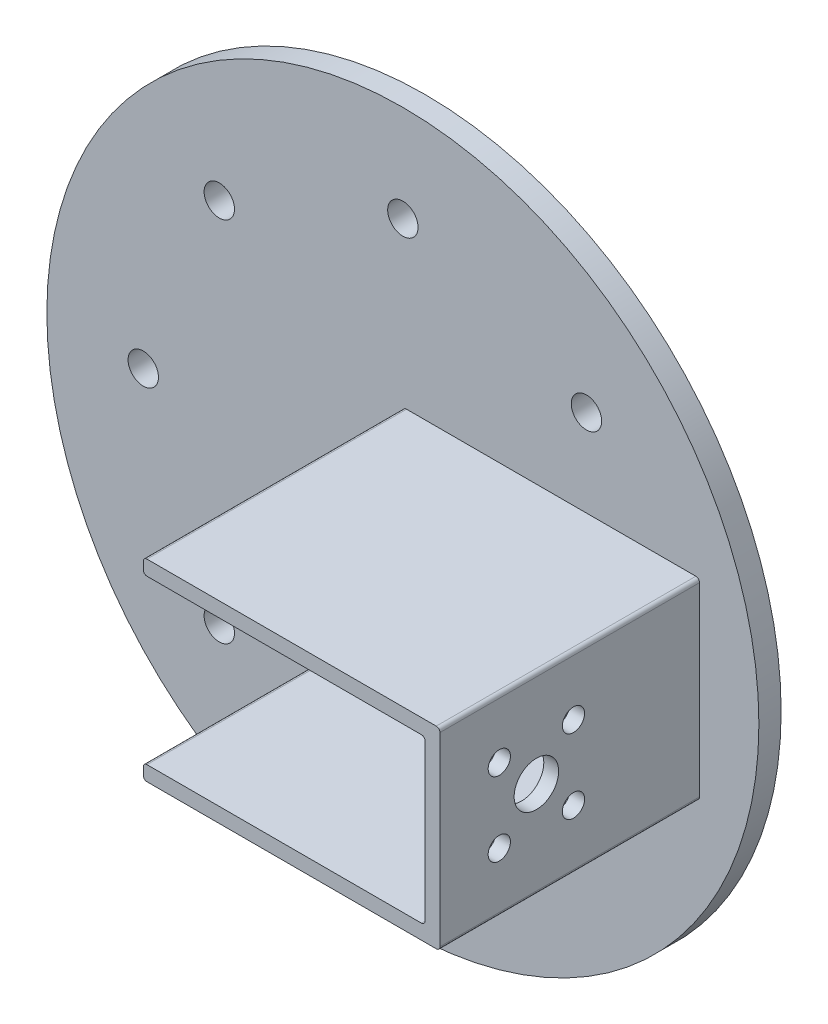
from build123d import *

# Parameters (mm, degrees)
SKETCH_3_R          = 48
EXTRUDE_2_DEPTH     = 3
SKETCH_4_R          = 3
CUT_EXTRUDE_1_DEPTH = 3
EXTRUDE_3_DEPTH     = 35
SKETCH_6_R          = 3
SKETCH_6_R_2        = 1.5
CUT_EXTRUDE_2_DEPTH = 35
SKETCH_7_R          = 1.55
CUT_EXTRUDE_5_DEPTH = 35
SKETCH_8_R          = 2.05
CUT_EXTRUDE_6_DEPTH = 10
SKETCH_9_R          = 1.55
CUT_EXTRUDE_7_DEPTH = 10


with BuildPart() as part:
    # 草图3 → 凸台-拉伸2 (new body)
    with BuildSketch(Plane.XY):
        Circle(SKETCH_3_R)
    extrude(amount=EXTRUDE_2_DEPTH)

    # 草图4 → 切除-拉伸1 (cut)
    with BuildSketch(Plane.XY.offset(3)):
        Circle(SKETCH_4_R)
    extrude(amount=-CUT_EXTRUDE_1_DEPTH, mode=Mode.SUBTRACT)

    # 草图5 → 凸台-拉伸3 (add)
    with BuildSketch(Plane.XY.offset(3)):
        with BuildLine():
            ThreePointArc((0, 12.5), (0.146446609, 12.853553391), (0.5, 13))
            Line((0.5, 13), (39.5, 13))
            ThreePointArc((39.5, 13), (39.853553391, 12.853553391), (40, 12.5))
            Line((40, 12.5), (40, -12.5))
            ThreePointArc((40, -12.5), (39.853553391, -12.853553391), (39.5, -13))
            Line((39.5, -13), (0.5, -13))
            ThreePointArc((0.5, -13), (0.146446609, -12.853553391), (0, -12.5))
            Line((0, -12.5), (0, -11.5))
            ThreePointArc((0, -11.5), (0.146446609, -11.146446609), (0.5, -11))
            Line((0.5, -11), (37.5, -11))
            ThreePointArc((37.5, -11), (37.853553391, -10.853553391), (38, -10.5))
            Line((38, -10.5), (38, 0))
            Line((38, 0), (38, 10.5))
            ThreePointArc((38, 10.5), (37.853553391, 10.853553391), (37.5, 11))
            Line((37.5, 11), (0.5, 11))
            ThreePointArc((0.5, 11), (0.146446609, 11.146446609), (0, 11.5))
            Line((0, 11.5), (0, 12.5))
        make_face()
    extrude(amount=EXTRUDE_3_DEPTH)

    # 草图6 → 切除-拉伸2 (cut)
    with BuildSketch(Plane(origin=(40, 0, 0), x_dir=(0, 0, -1), z_dir=(1, 0, 0))):
        with Locations((-25, 0)):
            Circle(SKETCH_6_R)
        with Locations((-20, -5)):
            Circle(SKETCH_6_R_2)
        with Locations((-20, 5)):
            Circle(SKETCH_6_R_2)
        with Locations((-30, -5)):
            Circle(SKETCH_6_R_2)
        with Locations((-30, 5)):
            Circle(SKETCH_6_R_2)
    extrude(amount=-CUT_EXTRUDE_2_DEPTH, mode=Mode.SUBTRACT)

    # 草图7 → 切除-拉伸5 (cut)
    with BuildSketch(Plane.XY.offset(3)):
        with Locations((-35, 0)):
            Circle(SKETCH_7_R)
        with Locations((-24.748737342, 24.748737342)):
            Circle(SKETCH_7_R)
        with Locations((0, 35)):
            Circle(SKETCH_7_R)
        with Locations((24.748737342, 24.748737342)):
            Circle(SKETCH_7_R)
        with Locations((35, 0)):
            Circle(SKETCH_7_R)
        with Locations((24.748737342, -24.748737342)):
            Circle(SKETCH_7_R)
        with Locations((0, -35)):
            Circle(SKETCH_7_R)
        with Locations((-24.748737342, -24.748737342)):
            Circle(SKETCH_7_R)
    extrude(amount=-CUT_EXTRUDE_5_DEPTH, mode=Mode.SUBTRACT)

    # 草图8 → 切除-拉伸6 (cut)
    with BuildSketch(Plane.XY.offset(3)):
        with Locations((0, 35)):
            Circle(SKETCH_8_R)
        with Locations((24.748737342, 24.748737342)):
            Circle(SKETCH_8_R)
        with Locations((35, 0)):
            Circle(SKETCH_8_R)
        with Locations((24.748737342, -24.748737342)):
            Circle(SKETCH_8_R)
        with Locations((0, -35)):
            Circle(SKETCH_8_R)
        with Locations((-24.748737342, -24.748737342)):
            Circle(SKETCH_8_R)
        with Locations((-35, 0)):
            Circle(SKETCH_8_R)
        with Locations((-24.748737342, 24.748737342)):
            Circle(SKETCH_8_R)
    extrude(amount=-CUT_EXTRUDE_6_DEPTH, mode=Mode.SUBTRACT)

    # 草图9 → 切除-拉伸7 (cut)
    with BuildSketch(Plane.XY.offset(3)):
        with Locations((-5, 5)):
            Circle(SKETCH_9_R)
        with Locations((5, 5)):
            Circle(SKETCH_9_R)
        with Locations((5, -5)):
            Circle(SKETCH_9_R)
        with Locations((-5, -5)):
            Circle(SKETCH_9_R)
    extrude(amount=-CUT_EXTRUDE_7_DEPTH, mode=Mode.SUBTRACT)


solid = part.part
